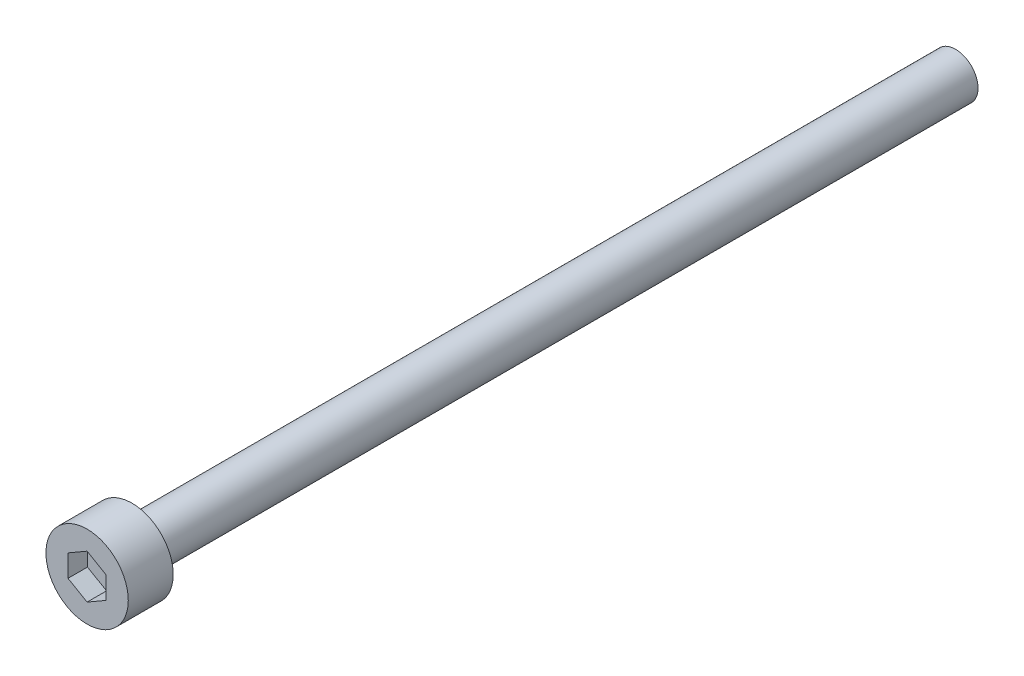
from build123d import *

# Parameters (mm, degrees)
SKETCH_1_R          = 2.75
EXTRUDE_1_DEPTH     = 3
CUT_EXTRUDE_1_DEPTH = 1.3
SKETCH_3_R          = 1.5
EXTRUDE_2_DEPTH     = 55


with BuildPart() as part:
    # 草图1 → 凸台-拉伸1 (new body)
    with BuildSketch(Plane.XY):
        Circle(SKETCH_1_R)
    extrude(amount=EXTRUDE_1_DEPTH)

    # 草图2 → 切除-拉伸1 (cut)
    with BuildSketch(Plane.XY.offset(3)):
        Polygon((1.275, -0.736121593), (1.275, 0.736121593), (0, 1.472243186), (-1.275, 0.736121593), (-1.275, -0.736121593), (0, -1.472243186), align=None)
    extrude(amount=-CUT_EXTRUDE_1_DEPTH, mode=Mode.SUBTRACT)

    # 草图3 → 凸台-拉伸2 (add)
    with BuildSketch(Plane(origin=(0, 0, 0), x_dir=(-1, 0, 0), z_dir=(0, 0, -1))):
        Circle(SKETCH_3_R)
    extrude(amount=EXTRUDE_2_DEPTH)


solid = part.part
